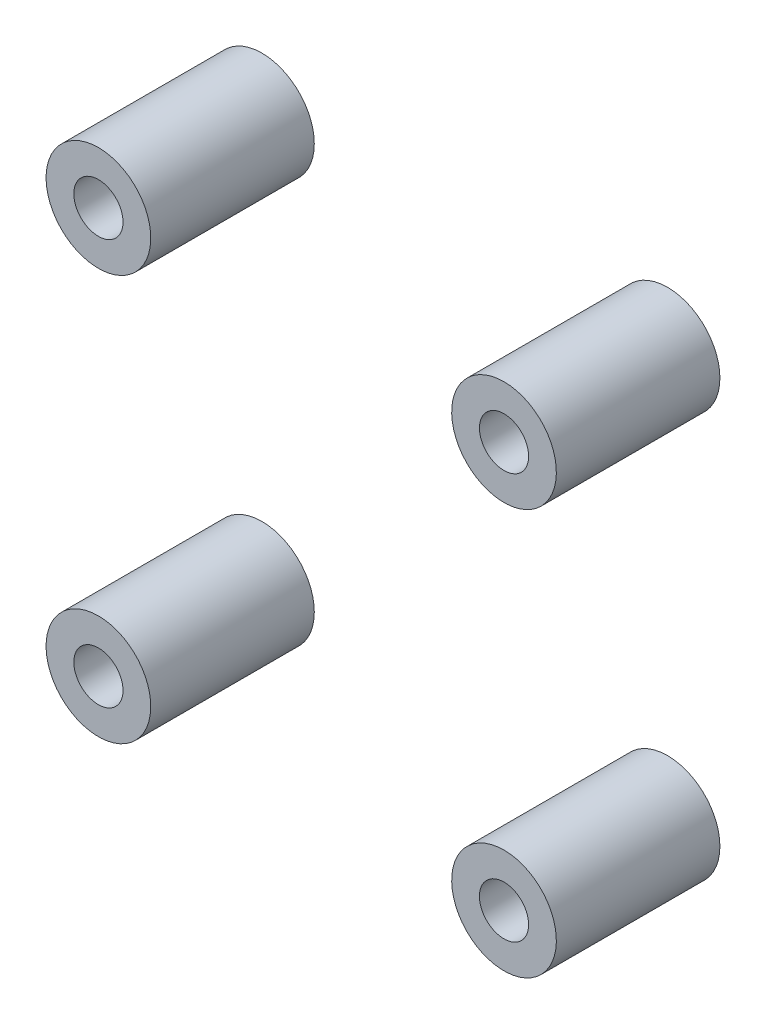
from build123d import *

# Parameters (mm, degrees)
SKETCH_1_R        = 4
SKETCH_1_R_2      = 1.88
EXTRUDE_1_DEPTH   = 12.5
EXTRUDE_1_2_DEPTH = 12.5
EXTRUDE_1_3_DEPTH = 12.5
EXTRUDE_1_4_DEPTH = 12.5


with BuildPart() as part:
    # 草图1 → 凸台-拉伸1 (new body)
    with BuildSketch(Plane.XY):
        with Locations(Location((15.5, 15.5, 0), (0, 0, 90))):
            Circle(SKETCH_1_R)
        with Locations(Location((15.5, 15.5, 0), (0, 0, 90))):
            Circle(SKETCH_1_R_2, mode=Mode.SUBTRACT)
    extrude(amount=EXTRUDE_1_DEPTH)


with BuildPart() as body_2:
    # 草图1 → Extrude 1 2 (new body)
    with BuildSketch(Plane.XY):
        with Locations(Location((15.5, -15.5, 0), (0, 0, 90))):
            Circle(SKETCH_1_R)
        with Locations(Location((15.5, -15.5, 0), (0, 0, 90))):
            Circle(SKETCH_1_R_2, mode=Mode.SUBTRACT)
    extrude(amount=EXTRUDE_1_2_DEPTH)


with BuildPart() as body_3:
    # 草图1 → Extrude 1 3 (new body)
    with BuildSketch(Plane.XY):
        with Locations(Location((-15.5, -15.5, 0), (0, 0, 90))):
            Circle(SKETCH_1_R)
        with Locations(Location((-15.5, -15.5, 0), (0, 0, 90))):
            Circle(SKETCH_1_R_2, mode=Mode.SUBTRACT)
    extrude(amount=EXTRUDE_1_3_DEPTH)


with BuildPart() as body_4:
    # 草图1 → Extrude 1 4 (new body)
    with BuildSketch(Plane.XY):
        with Locations(Location((-15.5, 15.5, 0), (0, 0, 90))):
            Circle(SKETCH_1_R)
        with Locations(Location((-15.5, 15.5, 0), (0, 0, 90))):
            Circle(SKETCH_1_R_2, mode=Mode.SUBTRACT)
    extrude(amount=EXTRUDE_1_4_DEPTH)


solid = Compound([part.part, body_2.part, body_3.part, body_4.part])
